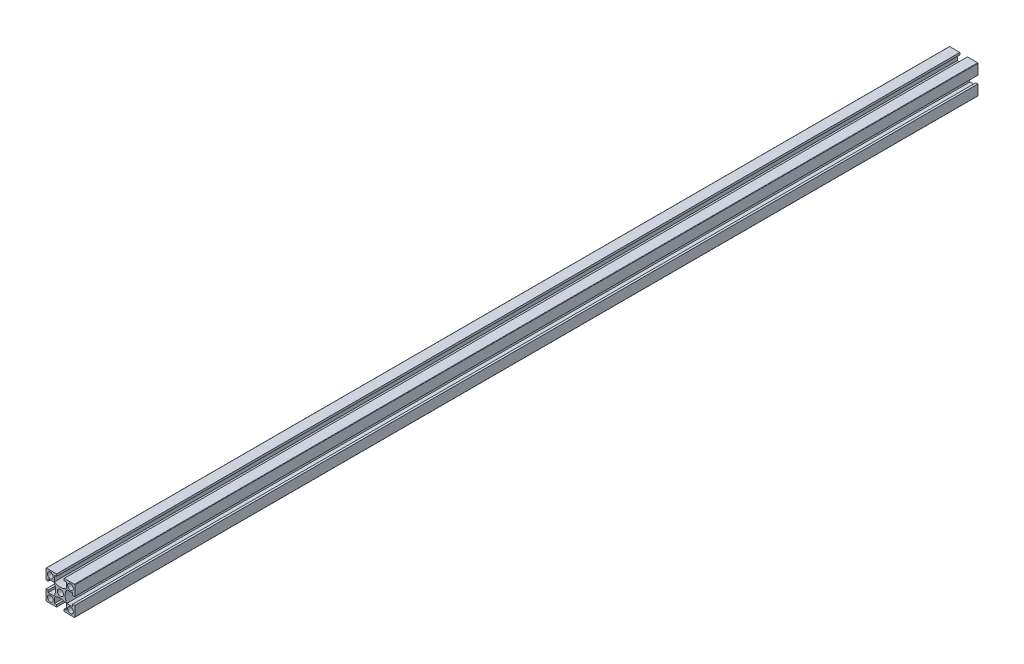
from build123d import *

# Parameters (mm, degrees)
SKETCH_1_W               = 20
SKETCH_1_H               = 20
SKETCH_1_R               = 2
SKETCH_1_R_2             = 2.15
EXTRUDE_1_DEPTH          = 628
CUT_EXTRUDE_1_REACH      = 630.159
PATTERN_CIRCULAR_1_COUNT = 4
FILLET_1_R               = 0.3
CUT_EXTRUDE_2_DEPTH      = 629.159215486
CUT_EXTRUDE_2_DEPTH_BACK = 629.159215486
SKETCH_2_R               = 2.5
SKETCH_3_R               = 2.5
CUT_EXTRUDE_3_DEPTH      = 629.397963177
SKETCH_5_R               = 2.15
SKETCH_5_R_2             = 2.12
CUT_EXTRUDE_5_DEPTH      = 629.397963177


with BuildPart() as part:
    # 스케치1 → 보스-돌출1 (new body)
    with BuildSketch(Plane.XY):
        Rectangle(SKETCH_1_W, SKETCH_1_H)
        with Locations((-7, -7)):
            Circle(SKETCH_1_R, mode=Mode.SUBTRACT)
        with Locations((7, -7)):
            Circle(SKETCH_1_R, mode=Mode.SUBTRACT)
        with Locations((-7, 7)):
            Circle(SKETCH_1_R, mode=Mode.SUBTRACT)
        Circle(SKETCH_1_R_2, mode=Mode.SUBTRACT)
        with Locations((7, 7)):
            Circle(SKETCH_1_R, mode=Mode.SUBTRACT)
    extrude(amount=EXTRUDE_1_DEPTH)

    # 스케치1<3> → 컷-돌출1 (cut, up to next)
    with BuildSketch(Plane.XY, mode=Mode.PRIVATE) as cut_extrude_1_sk1:
        with BuildLine():
            Line((-8.5, 2.65), (-10, 2.65))
            Line((-10, 2.65), (-10, -2.65))
            Line((-10, -2.65), (-8.5, -2.65))
            Line((-8.5, -2.65), (-8.5, -4.15))
            Line((-8.5, -4.15), (-4.503166667, -4.15))
            ThreePointArc((-4.503166667, -4.15), (-3.3, 0), (-4.503166667, 4.15))
            Line((-4.503166667, 4.15), (-8.5, 4.15))
            Line((-8.5, 4.15), (-8.5, 2.65))
        make_face()
    cut_extrude_1_tool1 = extrude(cut_extrude_1_sk1.sketch, amount=CUT_EXTRUDE_1_REACH, mode=Mode.PRIVATE) & part.part
    cut_extrude_1 = cut_extrude_1_tool1.solids().sort_by_distance((-6.606913, 0, 0))[0]
    add(cut_extrude_1, mode=Mode.SUBTRACT)

    # 원형 패턴1: 컷-돌출1 ×4 about axis
    pattern_circular_1_axis = Axis((0, 0, 628), (0, 0, -1))
    for i in range(1, PATTERN_CIRCULAR_1_COUNT):
        add(cut_extrude_1.rotate(pattern_circular_1_axis, i * 360 / PATTERN_CIRCULAR_1_COUNT), mode=Mode.SUBTRACT)

    # 필렛1
    fillet_1_edges = [part.edges().sort_by_distance(p)[0] for p in [
        (10, -10, 314),
        (-10, -10, 314),
        (-10, 10, 314),
        (10, 10, 314),
    ]]
    fillet(fillet_1_edges, radius=FILLET_1_R)

    # 스케치2 → 컷-돌출2 (cut, two sides: drawn at the far end of the back side and taken through both)
    with BuildSketch(Plane(origin=(0, 0, 0), x_dir=(0, 0, -1), z_dir=(1, 0, 0)).offset(-CUT_EXTRUDE_2_DEPTH_BACK)):
        with Locations((-15, 0)):
            Circle(SKETCH_2_R)
    extrude(amount=CUT_EXTRUDE_2_DEPTH + CUT_EXTRUDE_2_DEPTH_BACK, mode=Mode.SUBTRACT)

    # 스케치3 → 컷-돌출3 (cut, through all)
    with BuildSketch(Plane.XZ.offset(10)):
        with Locations((0, 141)):
            Circle(SKETCH_3_R)
        with Locations((0, 357)):
            Circle(SKETCH_3_R)
    extrude(amount=-CUT_EXTRUDE_3_DEPTH, mode=Mode.SUBTRACT)

    # 스케치5 → 컷-돌출5 (cut, through all)
    with BuildSketch(Plane.XZ.offset(10)):
        with Locations((0, 475)):
            Circle(SKETCH_5_R)
        with Locations((0, 423)):
            Circle(SKETCH_5_R)
        with Locations((0, 305)):
            Circle(SKETCH_5_R_2)
        with Locations((0, 238.9)):
            Circle(SKETCH_5_R)
        with Locations((0, 186.9)):
            Circle(SKETCH_5_R)
        with Locations((0, 64.15)):
            Circle(SKETCH_5_R)
        with Locations((0, 12.15)):
            Circle(SKETCH_5_R)
    extrude(amount=-CUT_EXTRUDE_5_DEPTH, mode=Mode.SUBTRACT)


solid = part.part
